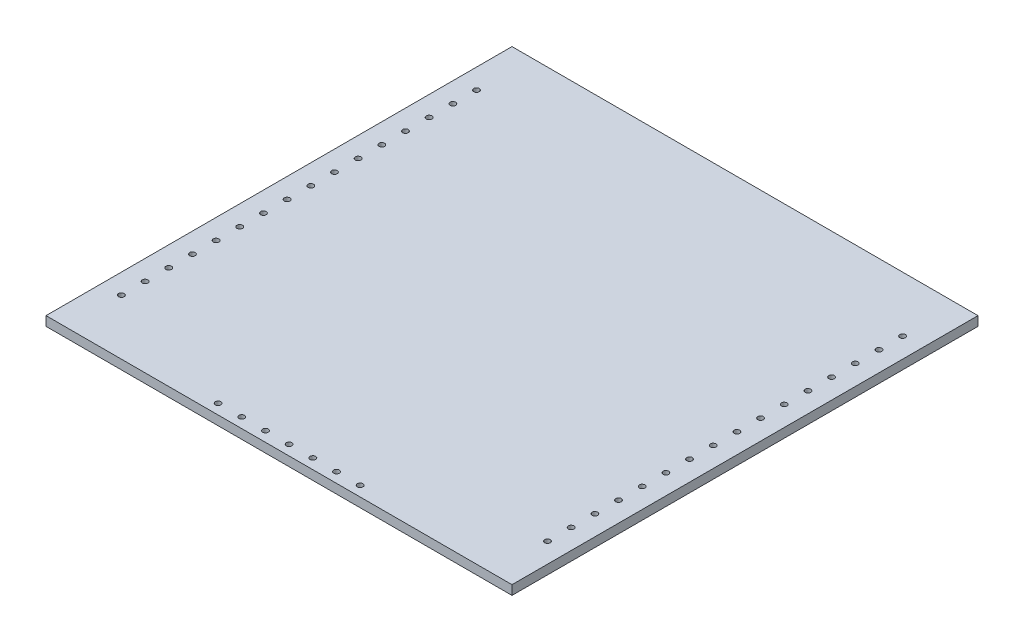
from build123d import *

# Parameters (mm, degrees)
SKETCH_1_W          = 50
SKETCH_1_H          = 50
EXTRUDE_1_DEPTH     = 1
SKETCH_2_R          = 0.3
CUT_EXTRUDE_1_DEPTH = 36.369478368
SKETCH_3_R          = 0.3
CUT_EXTRUDE_2_DEPTH = 36.369478368


with BuildPart() as part:
    # Эскиз1 → Бобышка-Вытянуть1 (new body)
    with BuildSketch(Plane(origin=(0, 0, 0), x_dir=(1, 0, 0), z_dir=(0, 1, 0))):
        Rectangle(SKETCH_1_W, SKETCH_1_H)
    extrude(amount=EXTRUDE_1_DEPTH)

    # Эскиз2 → Вырез-Вытянуть1 (cut, through all)
    with BuildSketch(Plane(origin=(0, 1, 0), x_dir=(1, 0, 0), z_dir=(0, 1, 0))):
        with Locations(Location((-22.86, -19.05, 0), (0, 0, 270))):
            Circle(SKETCH_2_R)
        with Locations(Location((-22.86, -16.51, 0), (0, 0, 270))):
            Circle(SKETCH_2_R)
        with Locations(Location((-22.86, -13.97, 0), (0, 0, 270))):
            Circle(SKETCH_2_R)
        with Locations(Location((-22.86, -11.43, 0), (0, 0, 270))):
            Circle(SKETCH_2_R)
        with Locations(Location((-22.86, -8.89, 0), (0, 0, 270))):
            Circle(SKETCH_2_R)
        with Locations(Location((-22.86, -6.35, 0), (0, 0, 270))):
            Circle(SKETCH_2_R)
        with Locations(Location((-22.86, -3.81, 0), (0, 0, 270))):
            Circle(SKETCH_2_R)
        with Locations(Location((-22.86, -1.27, 0), (0, 0, 270))):
            Circle(SKETCH_2_R)
        with Locations(Location((-22.86, 1.27, 0), (0, 0, 270))):
            Circle(SKETCH_2_R)
        with Locations(Location((-22.86, 3.81, 0), (0, 0, 270))):
            Circle(SKETCH_2_R)
        with Locations(Location((-22.86, 6.35, 0), (0, 0, 270))):
            Circle(SKETCH_2_R)
        with Locations(Location((-22.86, 8.89, 0), (0, 0, 270))):
            Circle(SKETCH_2_R)
        with Locations(Location((-22.86, 11.43, 0), (0, 0, 270))):
            Circle(SKETCH_2_R)
        with Locations(Location((-22.86, 13.97, 0), (0, 0, 270))):
            Circle(SKETCH_2_R)
        with Locations(Location((-22.86, 16.51, 0), (0, 0, 270))):
            Circle(SKETCH_2_R)
        with Locations(Location((-22.86, 19.05, 0), (0, 0, 270))):
            Circle(SKETCH_2_R)
        with Locations(Location((22.86, -19.05, 0), (0, 0, 270))):
            Circle(SKETCH_2_R)
        with Locations(Location((22.86, -16.51, 0), (0, 0, 270))):
            Circle(SKETCH_2_R)
        with Locations(Location((22.86, -13.97, 0), (0, 0, 270))):
            Circle(SKETCH_2_R)
        with Locations(Location((22.86, -11.43, 0), (0, 0, 270))):
            Circle(SKETCH_2_R)
        with Locations(Location((22.86, -8.89, 0), (0, 0, 270))):
            Circle(SKETCH_2_R)
        with Locations(Location((22.86, -6.35, 0), (0, 0, 270))):
            Circle(SKETCH_2_R)
        with Locations(Location((22.86, -3.81, 0), (0, 0, 270))):
            Circle(SKETCH_2_R)
        with Locations(Location((22.86, -1.27, 0), (0, 0, 270))):
            Circle(SKETCH_2_R)
        with Locations(Location((22.86, 1.27, 0), (0, 0, 270))):
            Circle(SKETCH_2_R)
        with Locations(Location((22.86, 3.81, 0), (0, 0, 270))):
            Circle(SKETCH_2_R)
        with Locations(Location((22.86, 6.35, 0), (0, 0, 270))):
            Circle(SKETCH_2_R)
        with Locations(Location((22.86, 8.89, 0), (0, 0, 270))):
            Circle(SKETCH_2_R)
        with Locations(Location((22.86, 11.43, 0), (0, 0, 270))):
            Circle(SKETCH_2_R)
        with Locations(Location((22.86, 13.97, 0), (0, 0, 270))):
            Circle(SKETCH_2_R)
        with Locations(Location((22.86, 16.51, 0), (0, 0, 270))):
            Circle(SKETCH_2_R)
        with Locations(Location((22.86, 19.05, 0), (0, 0, 270))):
            Circle(SKETCH_2_R)
    extrude(amount=-CUT_EXTRUDE_1_DEPTH, mode=Mode.SUBTRACT)

    # Эскиз3 → Вырез-Вытянуть2 (cut, through all)
    with BuildSketch(Plane.XZ):
        with Locations(Location((7.62, 23.91, 0), (0, 0, 270))):
            Circle(SKETCH_3_R)
        with Locations(Location((5.08, 23.91, 0), (0, 0, 270))):
            Circle(SKETCH_3_R)
        with Locations(Location((2.54, 23.91, 0), (0, 0, 270))):
            Circle(SKETCH_3_R)
        with Locations(Location((0, 23.91, 0), (0, 0, 270))):
            Circle(SKETCH_3_R)
        with Locations(Location((-2.54, 23.91, 0), (0, 0, 270))):
            Circle(SKETCH_3_R)
        with Locations(Location((-5.08, 23.91, 0), (0, 0, 270))):
            Circle(SKETCH_3_R)
        with Locations(Location((-7.62, 23.91, 0), (0, 0, 270))):
            Circle(SKETCH_3_R)
    extrude(amount=-CUT_EXTRUDE_2_DEPTH, mode=Mode.SUBTRACT)


solid = part.part
